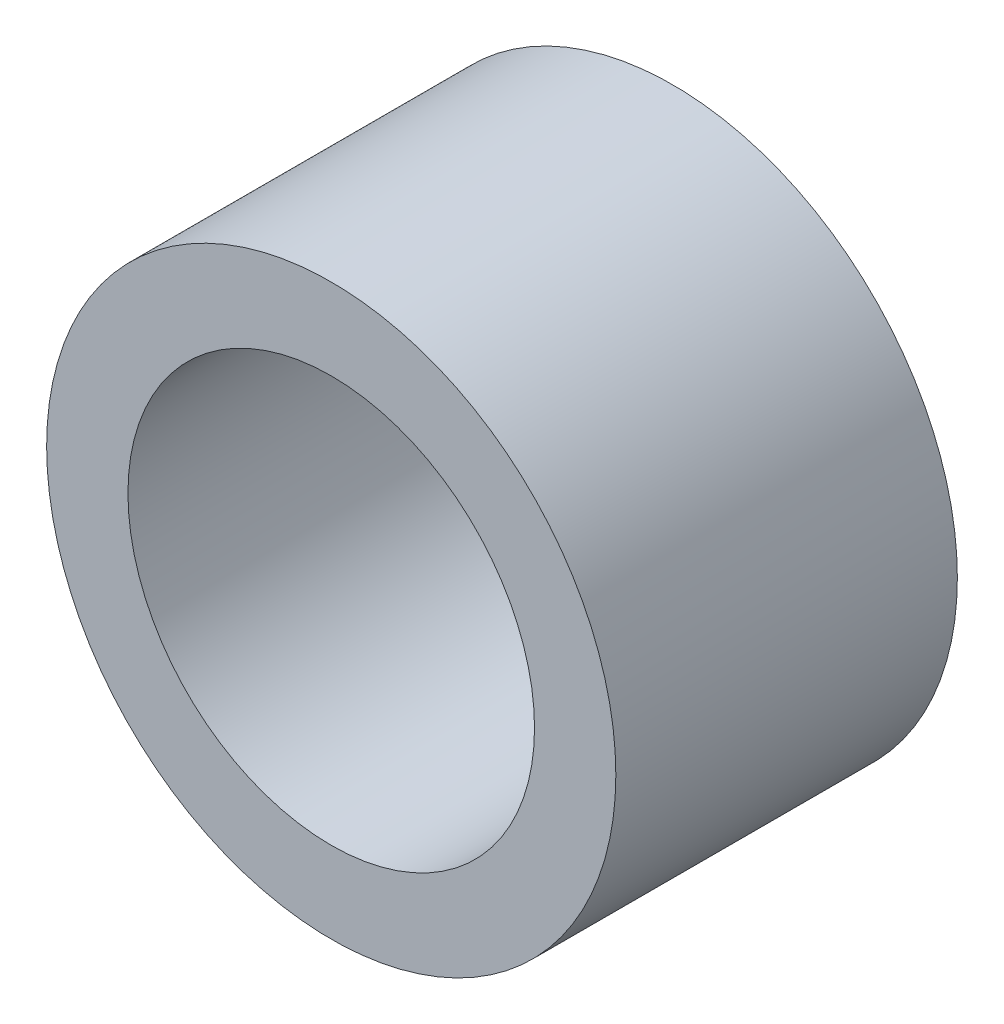
from build123d import *

# Parameters (mm, degrees)
SKETCH1_R                          = 17.5
SKETCH1_R_2                        = 12.5
OUTPUT_STOPPER_TUBE_35X25X21_DEPTH = 21


with BuildPart() as part:
    # Sketch1 → Output_Stopper_Tube_35x25x21 (new body)
    with BuildSketch(Plane.XY):
        with Locations(Location((0, 0, 0), (0, 0, 180))):
            Circle(SKETCH1_R)
        with Locations(Location((0, 0, 0), (0, 0, 180))):
            Circle(SKETCH1_R_2, mode=Mode.SUBTRACT)
    extrude(amount=OUTPUT_STOPPER_TUBE_35X25X21_DEPTH)


solid = part.part
